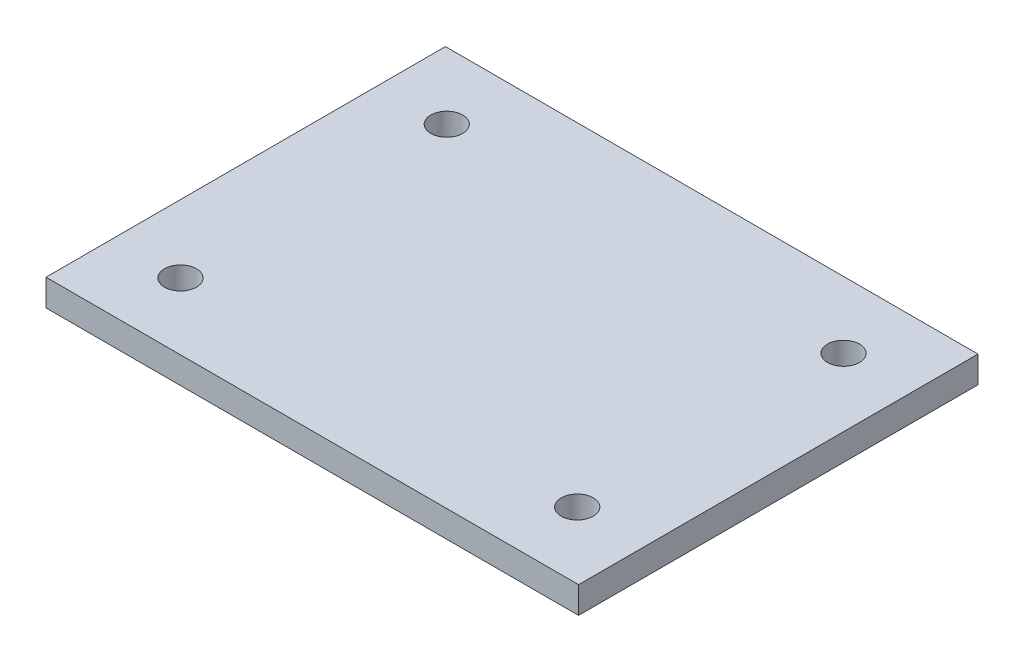
from build123d import *

# Parameters (mm, degrees)
SKETCH1_W           = 200
SKETCH1_H           = 150
BOSS_EXTRUDE1_DEPTH = 10
CUT_EXTRUDE1_REACH  = 127.399
SKETCH2_R           = 6


with BuildPart() as part:
    # Sketch1 → Boss-Extrude1 (new body)
    with BuildSketch(Plane(origin=(0, 0, 0), x_dir=(1, 0, 0), z_dir=(0, 1, 0))):
        Rectangle(SKETCH1_W, SKETCH1_H)
    extrude(amount=BOSS_EXTRUDE1_DEPTH)

    # Sketch2 → Cut-Extrude1 (cut, up to next)
    with BuildSketch(Plane(origin=(0, 10, 0), x_dir=(1, 0, 0), z_dir=(0, 1, 0)), mode=Mode.PRIVATE) as cut_extrude1_sk1:
        with Locations(Location((74.5, 50, 0), (0, 0, 270))):
            Circle(SKETCH2_R)
    cut_extrude1_tool1 = extrude(cut_extrude1_sk1.sketch, amount=-CUT_EXTRUDE1_REACH, mode=Mode.PRIVATE) & part.part
    # Sketch2 → Cut-Extrude1 (cut, up to next)
    with BuildSketch(Plane(origin=(0, 10, 0), x_dir=(1, 0, 0), z_dir=(0, 1, 0)), mode=Mode.PRIVATE) as cut_extrude1_sk2:
        with Locations(Location((74.5, -50, 0), (0, 0, 270))):
            Circle(SKETCH2_R)
    cut_extrude1_tool2 = extrude(cut_extrude1_sk2.sketch, amount=-CUT_EXTRUDE1_REACH, mode=Mode.PRIVATE) & part.part
    # Sketch2 → Cut-Extrude1 (cut, up to next)
    with BuildSketch(Plane(origin=(0, 10, 0), x_dir=(1, 0, 0), z_dir=(0, 1, 0)), mode=Mode.PRIVATE) as cut_extrude1_sk3:
        with Locations(Location((-74.5, -50, 0), (0, 0, 270))):
            Circle(SKETCH2_R)
    cut_extrude1_tool3 = extrude(cut_extrude1_sk3.sketch, amount=-CUT_EXTRUDE1_REACH, mode=Mode.PRIVATE) & part.part
    # Sketch2 → Cut-Extrude1 (cut, up to next)
    with BuildSketch(Plane(origin=(0, 10, 0), x_dir=(1, 0, 0), z_dir=(0, 1, 0)), mode=Mode.PRIVATE) as cut_extrude1_sk4:
        with Locations(Location((-74.5, 50, 0), (0, 0, 270))):
            Circle(SKETCH2_R)
    cut_extrude1_tool4 = extrude(cut_extrude1_sk4.sketch, amount=-CUT_EXTRUDE1_REACH, mode=Mode.PRIVATE) & part.part
    add(cut_extrude1_tool1.solids().sort_by_distance((74.5, 10, -50))[0], mode=Mode.SUBTRACT)
    add(cut_extrude1_tool2.solids().sort_by_distance((74.5, 10, 50))[0], mode=Mode.SUBTRACT)
    add(cut_extrude1_tool3.solids().sort_by_distance((-74.5, 10, 50))[0], mode=Mode.SUBTRACT)
    add(cut_extrude1_tool4.solids().sort_by_distance((-74.5, 10, -50))[0], mode=Mode.SUBTRACT)


solid = part.part
